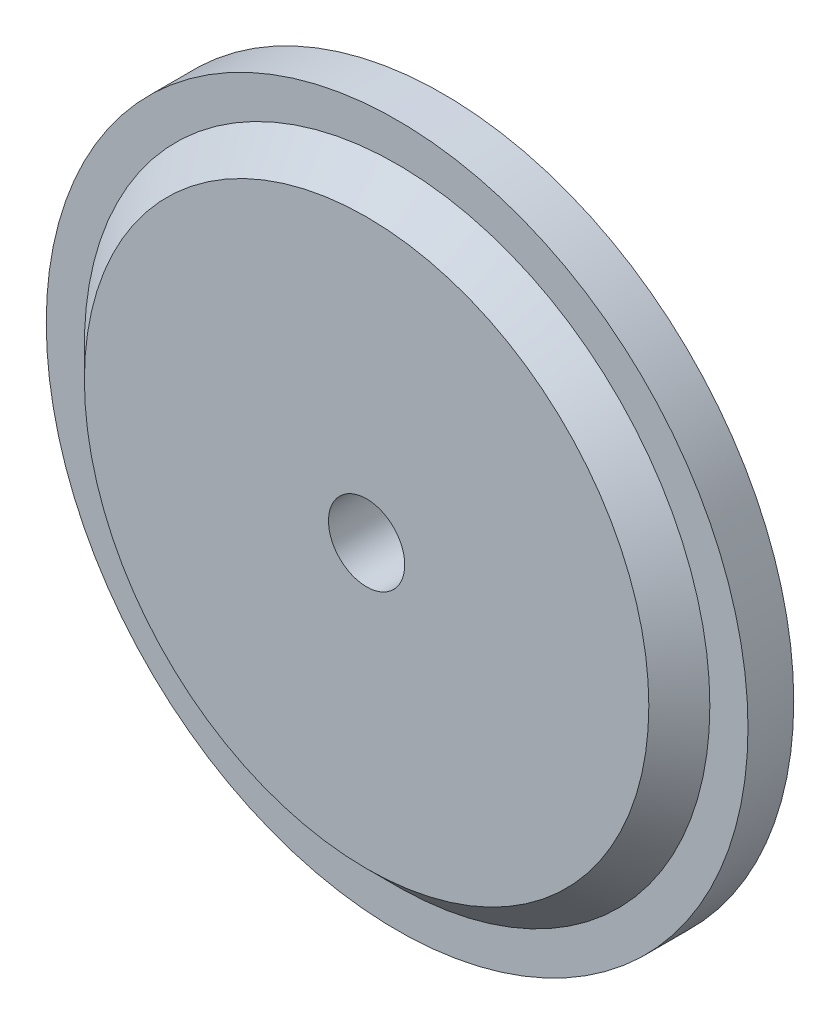
from build123d import *

# Parameters (mm, degrees)
SKETCH1_R           = 29.21
SKETCH1_R_2         = 3.175
BOSS_EXTRUDE1_DEPTH = 6.35


with BuildPart() as part:
    # Sketch1 → Boss-Extrude1 (new body)
    with BuildSketch(Plane.XY):
        Circle(SKETCH1_R)
        Circle(SKETCH1_R_2, mode=Mode.SUBTRACT)
    extrude(amount=BOSS_EXTRUDE1_DEPTH)

    # Sketch2 → Cut-Revolve1 (revolve, cut)
    with BuildSketch(Plane(origin=(0, 0, 0), x_dir=(0, 0, -1), z_dir=(1, 0, 0)), mode=Mode.PRIVATE) as cut_revolve1_sk:
        Polygon((-6.35, 29.21), (-3.81, 29.21), (-3.81, 26.035), (-6.35, 23.495), align=None)
    revolve(cut_revolve1_sk.sketch.rotate(Axis((0, 0, 6.35), (0, 0, -1)), 90), axis=Axis((0, 0, 6.35), (0, 0, -1)), mode=Mode.SUBTRACT)


solid = part.part
